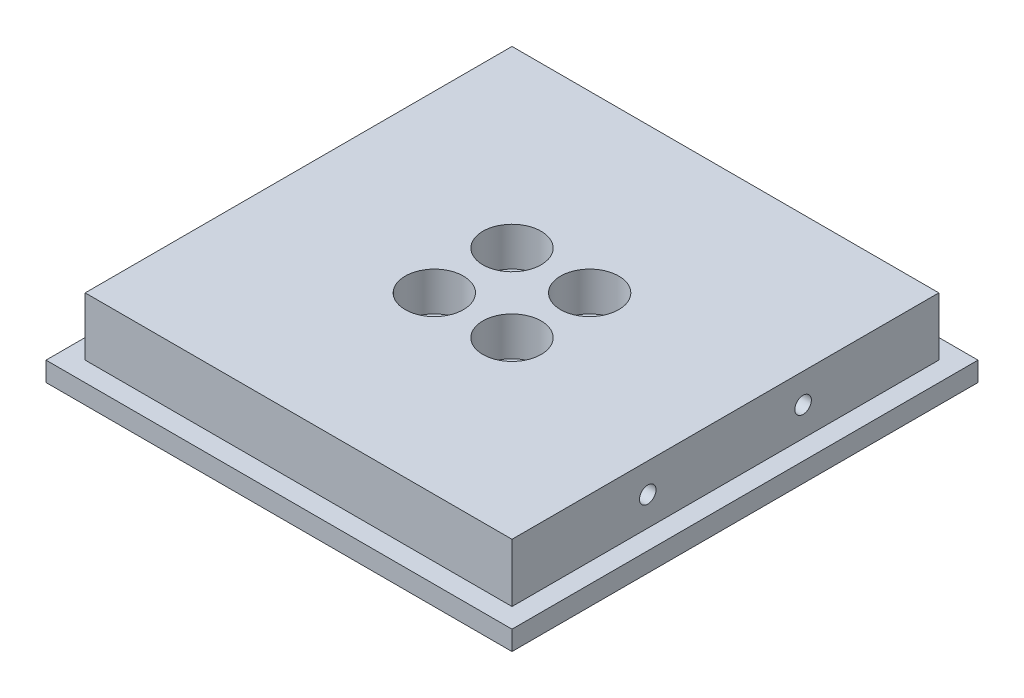
from build123d import *

# Parameters (mm, degrees)
SKETCH1_W           = 76.2
SKETCH1_H           = 76.2
BOSS_EXTRUDE1_DEPTH = 3.175
SKETCH2_W           = 69.79412
SKETCH2_H           = 69.79412
SKETCH2_W_2         = 57.09412
SKETCH2_H_2         = 57.09412
BOSS_EXTRUDE2_DEPTH = 9.525
SKETCH13_R          = 4.7625
SKETCH13_W          = 25.4
SKETCH13_H          = 25.4
CUT_EXTRUDE1_DEPTH  = 3.175
SKETCH15_R          = 2.5527
CUT_EXTRUDE2_DEPTH  = 55.716959208
SKETCH17_R          = 4.7625
CUT_EXTRUDE3_DEPTH  = 6.35


with BuildPart() as part:
    # Sketch1 → Boss-Extrude1 (new body)
    with BuildSketch(Plane(origin=(0, 0, 0), x_dir=(1, 0, 0), z_dir=(0, 1, 0))):
        Rectangle(SKETCH1_W, SKETCH1_H)
    extrude(amount=BOSS_EXTRUDE1_DEPTH)

    # Sketch2 → Boss-Extrude2 (add)
    # profile 1 of 2: a face of its own
    with BuildSketch(Plane(origin=(0, 3.175, 0), x_dir=(1, 0, 0), z_dir=(0, 1, 0))):
        Rectangle(SKETCH2_W, SKETCH2_H)
        Rectangle(SKETCH2_W_2, SKETCH2_H_2, mode=Mode.SUBTRACT)
    # profile 2 of 2: a face of its own
    with BuildSketch(Plane(origin=(0, 3.175, 0), x_dir=(1, 0, 0), z_dir=(0, 1, 0))):
        Rectangle(SKETCH2_W_2, SKETCH2_H_2)
    extrude(amount=BOSS_EXTRUDE2_DEPTH)

    # Sketch9 → #6-32 Tapped Hole2 (revolve, cut)
    with BuildSketch(Plane(origin=(34.89706, 7.9375, 12.7), x_dir=(0, 0, -1), z_dir=(0, 1, 0))):
        Polygon((0, 0), (0, 11.98869403), (1.35255, 11.176), (1.35255, 0), align=None)
    f_6_32_tapped_hole2 = revolve(axis=Axis((41.24706, 7.9375, 12.7), (-1, 0, 0)), mode=Mode.SUBTRACT)

    # Mirror1: #6-32 Tapped Hole2 across plane
    add(f_6_32_tapped_hole2.mirror(Plane.XY), mode=Mode.SUBTRACT)

    # Mirror2: #6-32 Tapped Hole2 across plane
    add(f_6_32_tapped_hole2.mirror(Plane(origin=(0, 0, 0), x_dir=(0, 0, 1), z_dir=(1, 0, 0))), mode=Mode.SUBTRACT)

    # Mirror2 copy 1 sketch → Mirror2 copy 1 (revolve, cut)
    with BuildSketch(Plane(origin=(-34.89706, 7.9375, -12.7), x_dir=(0, 0, 1), z_dir=(0, 1, 0))):
        Polygon((0, 0), (0, 11.98869403), (1.35255, 11.176), (1.35255, 0), align=None)
    revolve(axis=Axis((-41.24706, 7.9375, -12.7), (1, 0, 0)), mode=Mode.SUBTRACT)

    # Sketch13 → Cut-Extrude1 (cut)
    with BuildSketch(Plane.XZ):
        with Locations((-12.7, -7.9375)):
            Circle(SKETCH13_R)
        with Locations((7.9375, -12.7)):
            Circle(SKETCH13_R)
        with Locations((12.7, 7.9375)):
            Circle(SKETCH13_R)
        with Locations((-7.9375, 12.7)):
            Circle(SKETCH13_R)
        Rectangle(SKETCH13_W, SKETCH13_H)
        with BuildLine():
            ThreePointArc((12.7, 12.7), (7.9375, 7.9375), (12.7, 3.175))
            Line((12.7, 3.175), (12.7, 12.7))
        make_face()
        with BuildLine():
            Line((12.7, 12.7), (12.7, 3.175))
            ThreePointArc((12.7, 3.175), (16.067596045, 4.569903955), (17.4625, 7.9375))
            ThreePointArc((17.4625, 7.9375), (16.067596045, 11.305096045), (12.7, 12.7))
        make_face()
        with BuildLine():
            ThreePointArc((-3.175, 12.7), (-7.9375, 17.4625), (-12.7, 12.7))
            Line((-12.7, 12.7), (-3.175, 12.7))
        make_face()
        with BuildLine():
            Line((-3.175, 12.7), (-12.7, 12.7))
            ThreePointArc((-12.7, 12.7), (-7.9375, 7.9375), (-3.175, 12.7))
        make_face()
        with BuildLine():
            ThreePointArc((-12.7, -3.175), (-17.4625, -7.9375), (-12.7, -12.7))
            Line((-12.7, -12.7), (-12.7, -3.175))
        make_face()
        with BuildLine():
            Line((-12.7, -3.175), (-12.7, -12.7))
            ThreePointArc((-12.7, -12.7), (-9.332403955, -11.305096045), (-7.9375, -7.9375))
            ThreePointArc((-7.9375, -7.9375), (-9.332403955, -4.569903955), (-12.7, -3.175))
        make_face()
        with BuildLine():
            ThreePointArc((12.7, -12.7), (7.9375, -7.9375), (3.175, -12.7))
            Line((3.175, -12.7), (12.7, -12.7))
        make_face()
        with BuildLine():
            Line((12.7, -12.7), (3.175, -12.7))
            ThreePointArc((3.175, -12.7), (7.9375, -17.4625), (12.7, -12.7))
        make_face()
    extrude(amount=-CUT_EXTRUDE1_DEPTH, mode=Mode.SUBTRACT)

    # Sketch15 → Cut-Extrude2 (cut, through all)
    with BuildSketch(Plane.XZ.offset(-3.175)):
        with Locations(Location((-6.35, 6.35, 0), (0, 0, 270))):
            Circle(SKETCH15_R)
        with Locations(Location((6.35, 6.35, 0), (0, 0, 270))):
            Circle(SKETCH15_R)
        with Locations(Location((6.35, -6.35, 0), (0, 0, 270))):
            Circle(SKETCH15_R)
        with Locations(Location((-6.35, -6.35, 0), (0, 0, 270))):
            Circle(SKETCH15_R)
    extrude(amount=-CUT_EXTRUDE2_DEPTH, mode=Mode.SUBTRACT)

    # Sketch17 → Cut-Extrude3 (cut)
    with BuildSketch(Plane(origin=(0, 12.7, 0), x_dir=(1, 0, 0), z_dir=(0, 1, 0))):
        with Locations(Location((-6.35, 6.35, 0), (0, 0, 270))):
            Circle(SKETCH17_R)
        with Locations(Location((6.35, 6.35, 0), (0, 0, 270))):
            Circle(SKETCH17_R)
        with Locations(Location((6.35, -6.35, 0), (0, 0, 270))):
            Circle(SKETCH17_R)
        with Locations(Location((-6.35, -6.35, 0), (0, 0, 270))):
            Circle(SKETCH17_R)
    extrude(amount=-CUT_EXTRUDE3_DEPTH, mode=Mode.SUBTRACT)


solid = part.part
